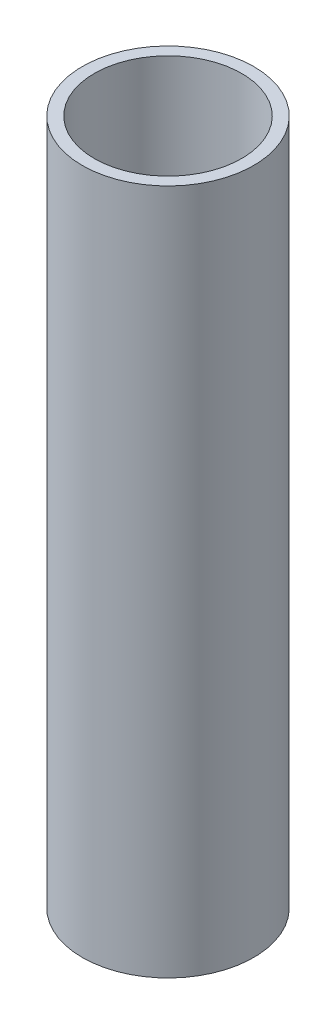
from build123d import *

# Parameters (mm, degrees)
SKETCH4_R           = 25
SKETCH4_R_2         = 21.5
BOSS_EXTRUDE1_DEPTH = 200


with BuildPart() as part:
    # Sketch4 → Boss-Extrude1 (new body)
    with BuildSketch(Plane(origin=(0, 0, 0), x_dir=(1, 0, 0), z_dir=(0, 1, 0))):
        with Locations(Location((0, 0, 0), (0, 0, 270))):
            Circle(SKETCH4_R)
        with Locations(Location((0, 0, 0), (0, 0, 270))):
            Circle(SKETCH4_R_2, mode=Mode.SUBTRACT)
    extrude(amount=BOSS_EXTRUDE1_DEPTH)


solid = part.part
